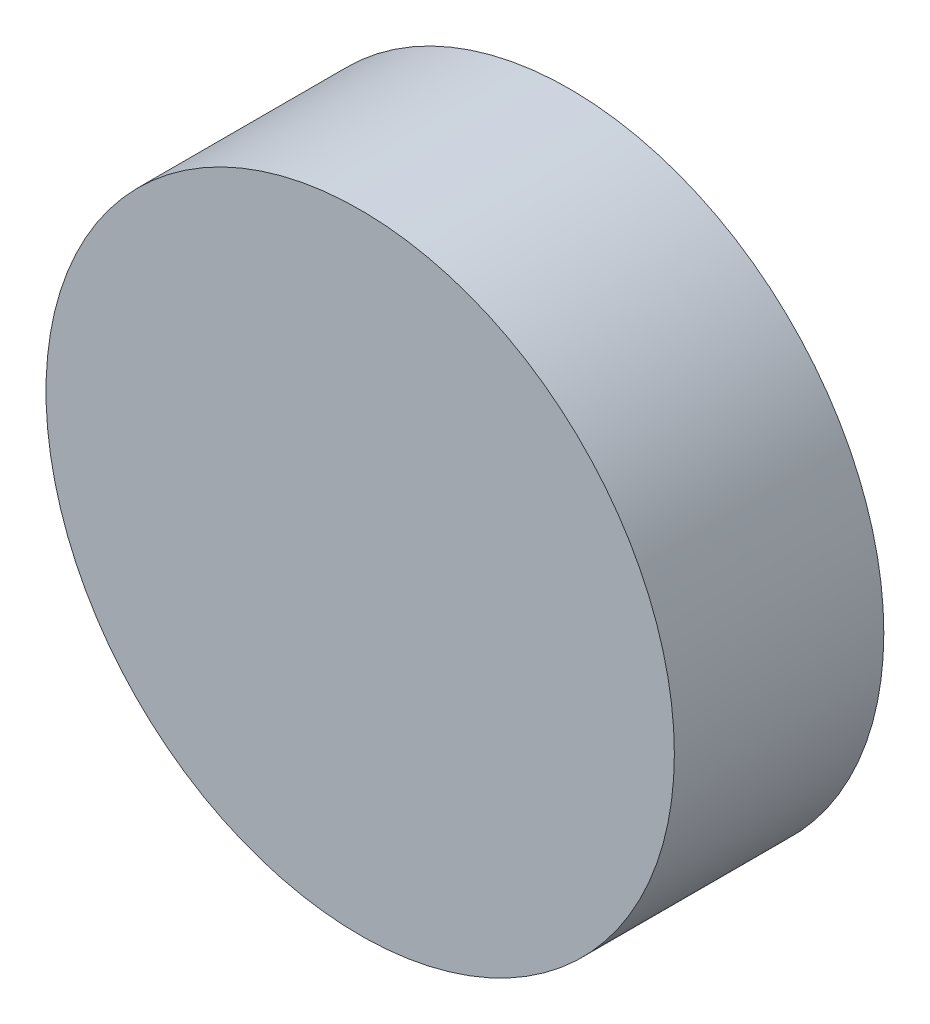
from build123d import *

# Parameters (mm, degrees)
SKETCH1_R           = 38.1
BOSS_EXTRUDE1_DEPTH = 12.7


with BuildPart() as part:
    # Sketch1 → Boss-Extrude1 (new, symmetric)
    with BuildSketch(Plane(origin=(0, 0, 0), x_dir=(0, 1, 0), z_dir=(0, 0, 1))):
        with Locations(Location((0, 0, 0), (0, 0, 270))):
            Circle(SKETCH1_R)
    extrude(amount=BOSS_EXTRUDE1_DEPTH, both=True)


solid = part.part
